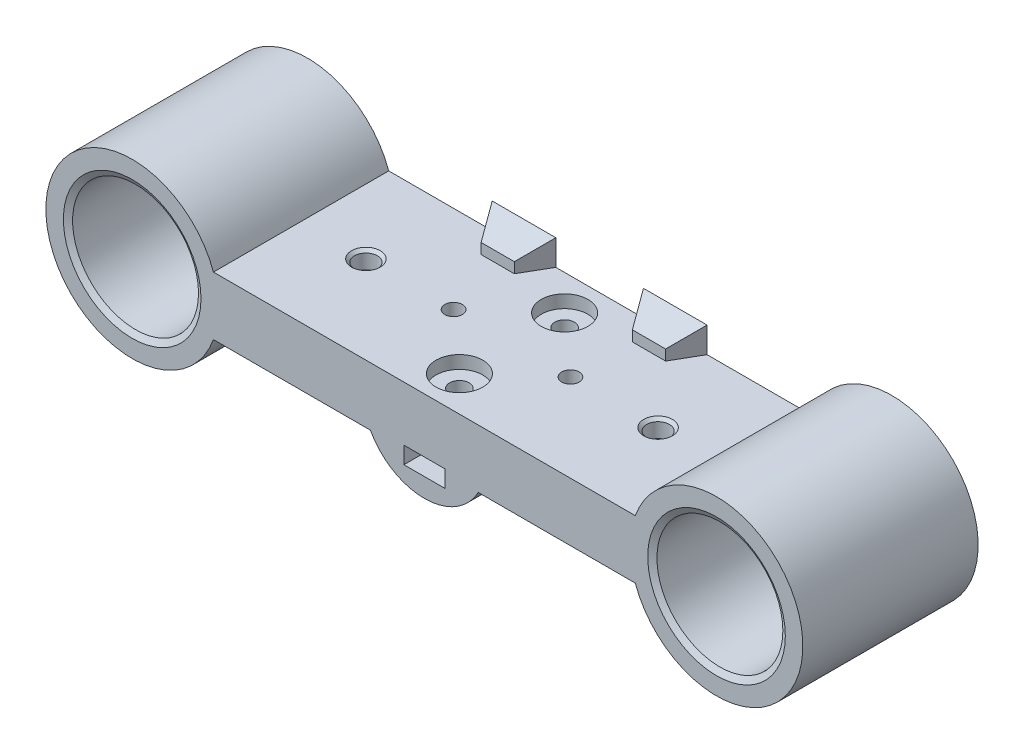
from build123d import *
from OCP.BRepFilletAPI import BRepFilletAPI_MakeChamfer

# Parameters (mm, degrees)
SKETCH1_R                     = 10.775
SKETCH1_W                     = 7
SKETCH1_H                     = 1.9
BOSS_EXTRUDE1_DEPTH           = 30
BOSS_EXTRUDE4_DEPTH           = 5
BOSS_EXTRUDE4_DEPTH_BACK      = 5
SKETCH30_R                    = 1.675
CUT_EXTRUDE14_DEPTH           = 75.167487823
SKETCH31_R                    = 4
CUT_EXTRUDE15_DEPTH           = 2.2
CHAMFER1_SIZE                 = 1
SKETCH42_W                    = 10.885616931
SKETCH42_H                    = 7.232184452
BOSS_EXTRUDE6_DEPTH           = 4.5
BOSS_EXTRUDE6_DRAFT           = -30
BOSS_EXTRUDE6_PROFILE_2_DEPTH = 4.5
BOSS_EXTRUDE6_PROFILE_2_DRAFT = -30
CUT_EXTRUDE16_DEPTH           = 73.897882342
CUT_EXTRUDE16_DEPTH_BACK      = 73.897882342
SKETCH43_R                    = 1.95
SKETCH43_R_2                  = 1.5
CHAMFER2_SIZE                 = 0.5
CHAMFER3_SIZE                 = 1
CHAMFER3_SIZE2                = 0.577350269
SKETCH44_R                    = 5.5
CUT_EXTRUDE17_DEPTH           = 7


with BuildPart() as part:
    # Sketch1 → Boss-Extrude1 (new body)
    with BuildSketch(Plane.XY):
        with BuildLine():
            Line((-33.091348368, 2.425), (33.073098334, 2.425))
            ThreePointArc((33.073098334, 2.425), (34.841312767, 3.001486492), (35.929959375, 4.509388186))
            ThreePointArc((35.929959375, 4.509388186), (64.775, 0), (35.929959375, -4.509388186))
            ThreePointArc((35.929959375, -4.509388186), (34.841312767, -3.001486492), (33.073098334, -2.425))
            Line((33.073098334, -2.425), (12.362013388, -2.425))
            ThreePointArc((12.362013388, -2.425), (10.721383427, -2.913360429), (9.614899302, -4.219444444))
            ThreePointArc((9.614899302, -4.219444444), (-0.006360753, -10.499998073), (-9.620004404, -4.207792208))
            ThreePointArc((-9.620004404, -4.207792208), (-10.717205737, -2.910276804), (-12.345672319, -2.425))
            Line((-12.345672319, -2.425), (-33.091348368, -2.425))
            ThreePointArc((-33.091348368, -2.425), (-34.84606209, -2.99758356), (-35.925333642, -4.494929577))
            ThreePointArc((-35.925333642, -4.494929577), (-64.775, 0), (-35.925333642, 4.494929577))
            ThreePointArc((-35.925333642, 4.494929577), (-34.84606209, 2.99758356), (-33.091348368, 2.425))
        make_face()
        with Locations((50, 0)):
            Circle(SKETCH1_R, mode=Mode.SUBTRACT)
        with Locations((-50, 0)):
            Circle(SKETCH1_R, mode=Mode.SUBTRACT)
        with Locations((0, -6.3)):
            Rectangle(SKETCH1_W, SKETCH1_H, mode=Mode.SUBTRACT)
    extrude(amount=BOSS_EXTRUDE1_DEPTH)

    # Sketch32 → Boss-Extrude4 (add, two sides: drawn at the far end of the back side and taken through both)
    with BuildSketch(Plane.XZ.offset(-BOSS_EXTRUDE4_DEPTH_BACK)):
        Polygon((-38.661098901, 30), (7.988715583, 30), (38.752094408, 30), (38.752094408, 0), (7.988715583, 0), (-38.661098901, 0), align=None)
    extrude(amount=BOSS_EXTRUDE4_DEPTH + BOSS_EXTRUDE4_DEPTH_BACK)

    # Sketch30 → Cut-Extrude14 (cut, through all)
    with BuildSketch(Plane(origin=(0, -5.35, 0), x_dir=(1, 0, 0), z_dir=(0, 1, 0))):
        with Locations((0, -6)):
            Circle(SKETCH30_R)
        with Locations((0, -24)):
            Circle(SKETCH30_R)
    extrude(amount=CUT_EXTRUDE14_DEPTH, mode=Mode.SUBTRACT)

    # Sketch31 → Cut-Extrude15 (cut)
    with BuildSketch(Plane(origin=(0, 5, 0), x_dir=(1, 0, 0), z_dir=(0, 1, 0))):
        with Locations((0, -6)):
            Circle(SKETCH31_R)
        with Locations((0, -24)):
            Circle(SKETCH31_R)
    extrude(amount=-CUT_EXTRUDE15_DEPTH, mode=Mode.SUBTRACT)

    # Chamfer1
    chamfer1_edges = [part.edges().sort_by_distance(p)[0] for p in [
        (0, -5.35, 30),
        (0, -5.35, 0),
    ]]
    chamfer(chamfer1_edges, length=CHAMFER1_SIZE)


with BuildPart() as boss_extrude6_tool:
    # Sketch42 → Boss-Extrude6 (with draft: the straight prism first)
    with BuildSketch(Plane(origin=(0, 0, 0), x_dir=(-1, 0, 0), z_dir=(0, 0, -1))):
        with Locations((-12.942808466, 5.778527688)):
            Rectangle(SKETCH42_W, SKETCH42_H)
    extrude(amount=-BOSS_EXTRUDE6_DEPTH)
    # Boss-Extrude6: the draft: its side faces are tilted about the plane it starts from
    boss_extrude6_sides = [boss_extrude6_tool.faces().sort_by_distance(p)[0] for p in [
        (7.5, 5.778527688, 2.25),
        (12.942808466, 9.394619914, 2.25),
        (18.385616931, 5.778527688, 2.25),
        (12.942808466, 2.162435462, 2.25),
    ]]
    draft(boss_extrude6_sides, Plane(origin=(0, 0, 0), x_dir=(-1, 0, 0), z_dir=(0, 0, -1)), BOSS_EXTRUDE6_DRAFT)


with BuildPart() as part_1:
    add(part.part)

    # Boss-Extrude6: add boss_extrude6_tool
    add(boss_extrude6_tool.part)


with BuildPart() as boss_extrude6_profile_2_tool:
    # Sketch42 → Boss-Extrude6 profile 2 (with draft: the straight prism first)
    with BuildSketch(Plane(origin=(0, 0, 0), x_dir=(-1, 0, 0), z_dir=(0, 0, -1))):
        with Locations((12.942808466, 5.778527688)):
            Rectangle(SKETCH42_W, SKETCH42_H)
    extrude(amount=-BOSS_EXTRUDE6_PROFILE_2_DEPTH)
    # Boss-Extrude6 profile 2: the draft: its side faces are tilted about the plane it starts from
    boss_extrude6_profile_2_sides = [boss_extrude6_profile_2_tool.faces().sort_by_distance(p)[0] for p in [
        (-18.385616931, 5.778527688, 2.25),
        (-12.942808466, 9.394619914, 2.25),
        (-7.5, 5.778527688, 2.25),
        (-12.942808466, 2.162435462, 2.25),
    ]]
    draft(boss_extrude6_profile_2_sides, Plane(origin=(0, 0, 0), x_dir=(-1, 0, 0), z_dir=(0, 0, -1)), BOSS_EXTRUDE6_PROFILE_2_DRAFT)


with BuildPart() as part_2:
    add(part_1.part)

    # Boss-Extrude6 profile 2: add boss_extrude6_profile_2_tool
    add(boss_extrude6_profile_2_tool.part)

    # Sketch43 → Cut-Extrude16 (cut, two sides: drawn at the far end of the back side and taken through both)
    with BuildSketch(Plane(origin=(0, 0, 0), x_dir=(1, 0, 0), z_dir=(0, 1, 0)).offset(-CUT_EXTRUDE16_DEPTH_BACK)):
        with Locations((25, -15)):
            Circle(SKETCH43_R)
        with Locations((-25, -15)):
            Circle(SKETCH43_R)
        with Locations((10, -15)):
            Circle(SKETCH43_R_2)
        with Locations((-10, -15)):
            Circle(SKETCH43_R_2)
    extrude(amount=CUT_EXTRUDE16_DEPTH + CUT_EXTRUDE16_DEPTH_BACK, mode=Mode.SUBTRACT)

    # Chamfer2
    chamfer2_edges = [part_2.edges().sort_by_distance(p)[0] for p in [
        (23.05, 5, 15),
        (-26.95, 5, 15),
    ]]
    chamfer(chamfer2_edges, length=CHAMFER2_SIZE)

    # Chamfer3: one chamfer whose edges measure the first distance from different faces: ONE call of the kernel's chamfer builder (chamfer() names one face for all edges)
    chamfer3_edges_1 = [part_2.edges().sort_by_distance(p)[0] for p in [
        (-60.775, 0, 30),
        (39.225, 0, 30),
    ]]
    chamfer3_side_1 = [part_2.faces().sort_by_distance(p)[0] for p in [
        (0, -0.289813178, 30),
    ]]
    chamfer3_edges_2 = [part_2.edges().sort_by_distance(p)[0] for p in [
        (39.225, 0, 0),
    ]]
    chamfer3_side_2 = [part_2.faces().sort_by_distance(p)[0] for p in [
        (39.225, 0, 15),
    ]]
    chamfer3_edges_3 = [part_2.edges().sort_by_distance(p)[0] for p in [
        (-60.775, 0, 0),
    ]]
    chamfer3_side_3 = [part_2.faces().sort_by_distance(p)[0] for p in [
        (-60.775, 0, 15),
    ]]
    chamfer3 = BRepFilletAPI_MakeChamfer(part_2.part.solid().wrapped)
    for e in chamfer3_edges_1:
        chamfer3.Add(CHAMFER3_SIZE, CHAMFER3_SIZE2, e.wrapped, chamfer3_side_1[0].wrapped)  # the first distance lies on this face
    for e in chamfer3_edges_2:
        chamfer3.Add(CHAMFER3_SIZE, CHAMFER3_SIZE2, e.wrapped, chamfer3_side_2[0].wrapped)  # the first distance lies on this face
    for e in chamfer3_edges_3:
        chamfer3.Add(CHAMFER3_SIZE, CHAMFER3_SIZE2, e.wrapped, chamfer3_side_3[0].wrapped)  # the first distance lies on this face
    add(Compound.cast(chamfer3.Shape()), mode=Mode.REPLACE)

    # Sketch44 → Cut-Extrude17 (cut)
    with BuildSketch(Plane.XZ.offset(5)):
        with Locations((25, 15)):
            Circle(SKETCH44_R)
        with Locations((-25, 15)):
            Circle(SKETCH44_R)
    extrude(amount=-CUT_EXTRUDE17_DEPTH, mode=Mode.SUBTRACT)


solid = part_2.part
